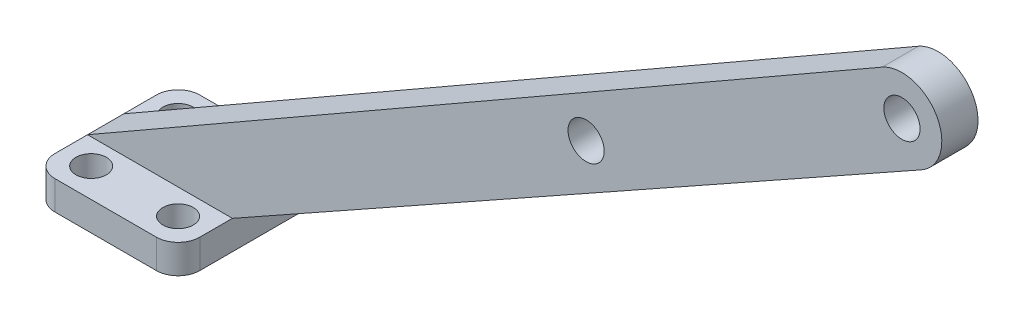
from build123d import *

# Parameters (mm, degrees)
SKETCH1_R           = 2.5
BOSS_EXTRUDE1_DEPTH = 5
SKETCH4_R           = 2.1
BOSS_EXTRUDE3_DEPTH = 4
SKETCH5_R           = 2.5
CUT_EXTRUDE1_DEPTH  = 10


with BuildPart() as part:
    # Sketch1 → Boss-Extrude1 (new body)
    with BuildSketch(Plane.XY):
        with BuildLine():
            Line((10, 0), (-10, 0))
            Line((-10, 0), (99.703266961, 62.930774809))
            ThreePointArc((99.703266961, 62.930774809), (107.223867063, 60.873782586), (105.130769502, 53.363151088))
            Line((105.130769502, 53.363151088), (10, 0))
        make_face()
        with Locations((102.44, 58.16)):
            Circle(SKETCH1_R, mode=Mode.SUBTRACT)
    extrude(amount=BOSS_EXTRUDE1_DEPTH)

    # Sketch4 → Boss-Extrude3 (add)
    with BuildSketch(Plane.XZ):
        with BuildLine():
            Line((7, -7.5), (-7, -7.5))
            ThreePointArc((-7, -7.5), (-9.121320344, -6.621320344), (-10, -4.5))
            Line((-10, -4.5), (-10, 9.5))
            ThreePointArc((-10, 9.5), (-9.121320344, 11.621320344), (-7, 12.5))
            Line((-7, 12.5), (7, 12.5))
            ThreePointArc((7, 12.5), (9.121320344, 11.621320344), (10, 9.5))
            Line((10, 9.5), (10, -4.5))
            ThreePointArc((10, -4.5), (9.121320344, -6.621320344), (7, -7.5))
        make_face()
        with Locations((-6, 8.5)):
            Circle(SKETCH4_R, mode=Mode.SUBTRACT)
        with Locations((5.99988022, 8.5)):
            Circle(SKETCH4_R, mode=Mode.SUBTRACT)
        with Locations(Location((5.99988022, -3.5, 0), (0, 0, 180))):
            Circle(SKETCH4_R, mode=Mode.SUBTRACT)
        with Locations(Location((-6, -3.5, 0), (0, 0, 180))):
            Circle(SKETCH4_R, mode=Mode.SUBTRACT)
    extrude(amount=BOSS_EXTRUDE3_DEPTH)

    # Sketch5 → Cut-Extrude1 (cut)
    with BuildSketch(Plane.XY.offset(5)):
        with Locations((58.832282615, 33.698459075)):
            Circle(SKETCH5_R)
    extrude(amount=-CUT_EXTRUDE1_DEPTH, mode=Mode.SUBTRACT)


solid = part.part
